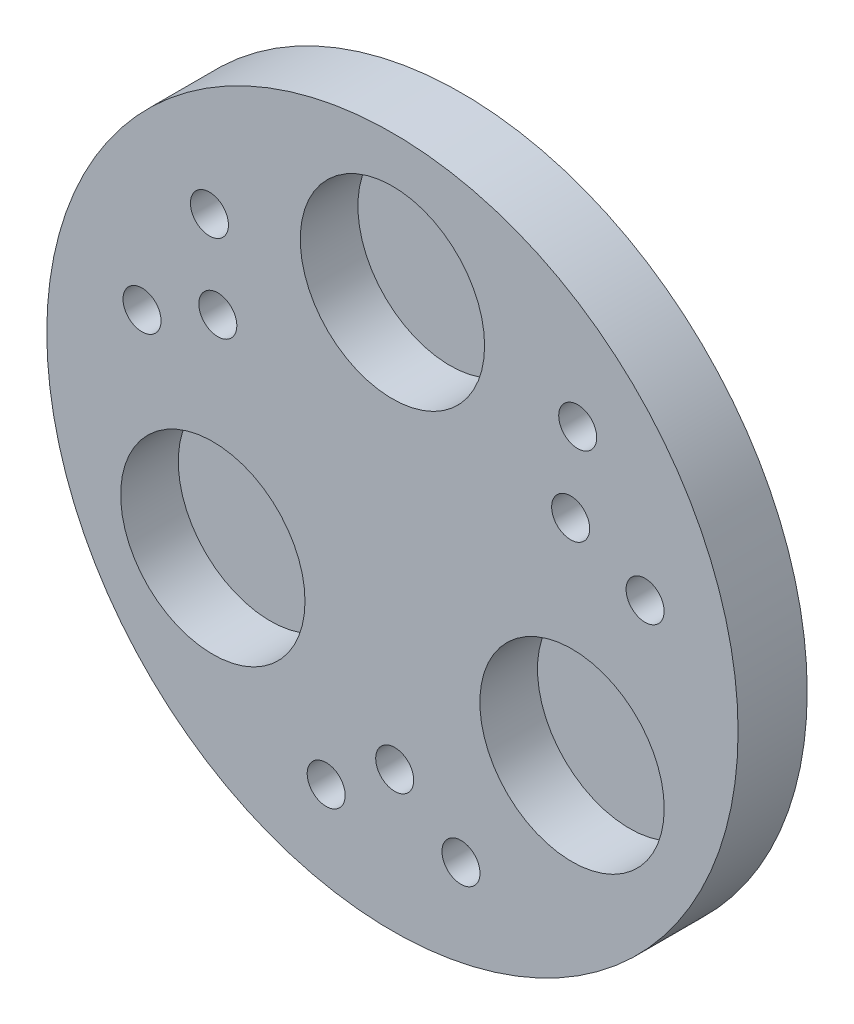
from build123d import *

# Parameters (mm, degrees)
SKETCH1_R           = 30
SKETCH1_R_2         = 8
BOSS_EXTRUDE1_DEPTH = 2.5
SKETCH3_R           = 30
BOSS_EXTRUDE2_DEPTH = 1
CIRPATTERN1_COUNT   = 3
CIRPATTERN2_COUNT   = 12


with BuildPart() as part:
    # Sketch1 → Boss-Extrude1 (new, symmetric)
    with BuildSketch(Plane.XY):
        Circle(SKETCH1_R)
        with Locations((0, 18)):
            Circle(SKETCH1_R_2, mode=Mode.SUBTRACT)
        with Locations((15.588457268, -9)):
            Circle(SKETCH1_R_2, mode=Mode.SUBTRACT)
        with Locations((-15.588457268, -9)):
            Circle(SKETCH1_R_2, mode=Mode.SUBTRACT)
    extrude(amount=BOSS_EXTRUDE1_DEPTH, both=True)

    # Sketch3 → Boss-Extrude2 (add)
    with BuildSketch(Plane(origin=(0, 0, -2.5), x_dir=(-1, 0, 0), z_dir=(0, 0, -1))):
        Circle(SKETCH3_R)
    extrude(amount=BOSS_EXTRUDE2_DEPTH)

    # Sketch6 → M4x0.7 Tapped Hole1 (revolve, cut)
    with BuildSketch(Plane(origin=(-21.733331092, 5.823428515, -3.5), x_dir=(0, 1, 0), z_dir=(1, 0, 0))):
        Polygon((0, 0), (0, 11.091420021), (1.65, 10.1), (1.65, 0.375), (2.025, 0), align=None)
    m4x0_7_tapped_hole1 = revolve(axis=Axis((-21.733331092, 5.823428515, -9.85), (0, 0, 1)), mode=Mode.SUBTRACT)

    # Sketch8 → M4x0.7 Tapped Hole2 (revolve, cut)
    with BuildSketch(Plane(origin=(-15.155444566, 8.75, -3.5), x_dir=(0, 1, 0), z_dir=(1, 0, 0))):
        Polygon((0, 0), (0, 11.091420021), (1.65, 10.1), (1.65, 0.375), (2.025, 0), align=None)
    m4x0_7_tapped_hole2 = revolve(axis=Axis((-15.155444566, 8.75, -9.85), (0, 0, 1)), mode=Mode.SUBTRACT)

    # CirPattern1: M4x0.7 Tapped Hole2 ×3 about axis
    cirpattern1_axis = Axis((0.169620148, -0.06701082, 0), (0, 0, 1))
    for i in range(1, CIRPATTERN1_COUNT):
        add(m4x0_7_tapped_hole2.rotate(cirpattern1_axis, i * 360 / CIRPATTERN1_COUNT), mode=Mode.SUBTRACT)

    # CirPattern2: M4x0.7 Tapped Hole1 ×12 about axis, 6 skipped
    cirpattern2_axis = Axis((0.098499141, -0.026092579, 0), (0, 0, -1))
    add([m4x0_7_tapped_hole1.rotate(cirpattern2_axis, i * 360 / CIRPATTERN2_COUNT) for i in range(1, CIRPATTERN2_COUNT) if i not in (2, 3, 6, 7, 10, 11)], mode=Mode.SUBTRACT)


solid = part.part
